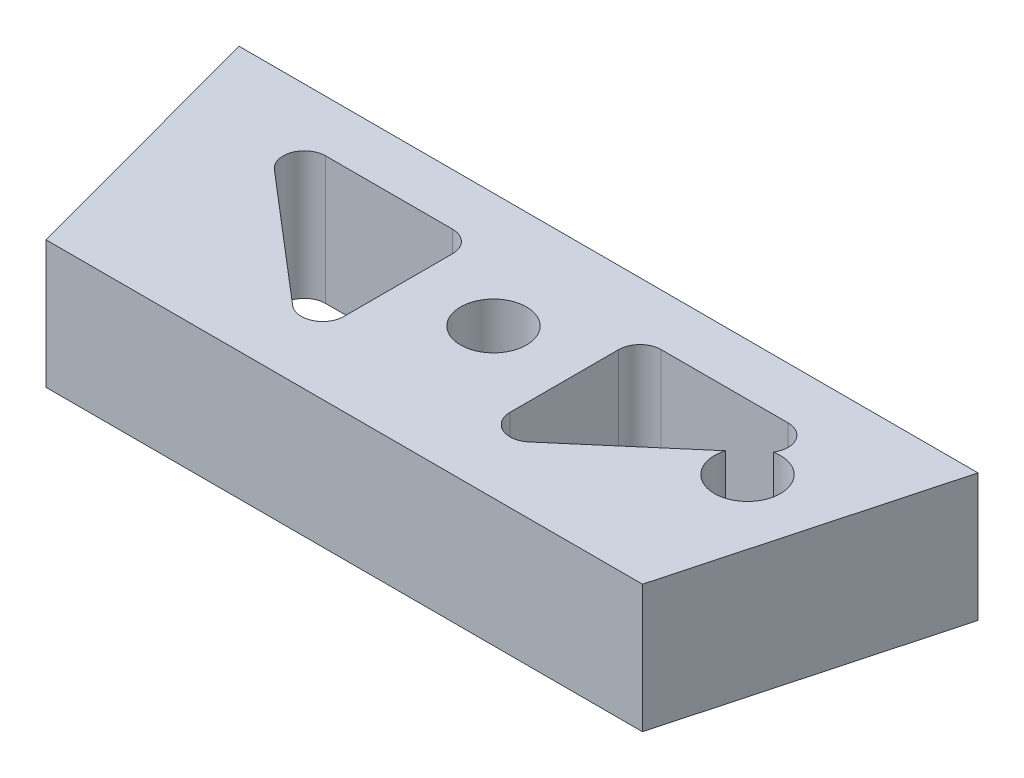
from build123d import *

# Parameters (mm, degrees)
EXTRUDE_1_DEPTH     = 1
EXTRUDE_START       = 5
EXTRUDE_2_DEPTH     = 5
CUT_EXTRUDE_1_REACH = 25.286
SKETCH_2_R          = 1.55
SKETCH_3_R          = 1.55
CUT_EXTRUDE_2_DEPTH = 6


with BuildPart() as part:
    # 草图1 → 凸台-拉伸1 (new body)
    with BuildSketch(Plane(origin=(0, 0, 0), x_dir=(1, 0, 0), z_dir=(0, 1, 0))):
        Polygon((-0.862647581, -12.802774991), (12.834963402, -12.802774991), (16.186049163, -0.402774991), (-18.501877746, -0.402774991), (-15.165036598, -12.802774991), align=None)
        with BuildLine():
            Line((-5.055880083, -8.924536815), (-5.055880083, -3.827423548))
            ThreePointArc((-5.055880083, -3.827423548), (-5.348773301, -3.120316767), (-6.055880083, -2.827423548))
            Line((-6.055880083, -2.827423548), (-12.010923306, -2.827423548))
            ThreePointArc((-12.010923306, -2.827423548), (-12.948929404, -3.480804795), (-12.661184313, -4.587134428))
            Line((-12.661184313, -4.587134428), (-6.70614109, -9.684247695))
            ThreePointArc((-6.70614109, -9.684247695), (-5.63770608, -9.832903758), (-5.055880083, -8.924536815))
        make_face(mode=Mode.SUBTRACT)
        with BuildLine():
            Line((10.34535573, -4.587134428), (4.390312507, -9.684247695))
            ThreePointArc((4.390312507, -9.684247695), (3.321877497, -9.832903758), (2.740051499, -8.924536815))
            Line((2.740051499, -8.924536815), (2.740051499, -3.827423548))
            ThreePointArc((2.740051499, -3.827423548), (3.032944718, -3.120316767), (3.740051499, -2.827423548))
            Line((3.740051499, -2.827423548), (9.695094722, -2.827423548))
            ThreePointArc((9.695094722, -2.827423548), (10.63310082, -3.480804795), (10.34535573, -4.587134428))
        make_face(mode=Mode.SUBTRACT)
    extrude(amount=-EXTRUDE_1_DEPTH)

    # 草图1<8> → 凸台-拉伸2 (add)
    with BuildSketch(Plane(origin=(0, 0, 0), x_dir=(1, 0, 0), z_dir=(0, 1, 0)).offset(EXTRUDE_START)):
        Polygon((-0.862647581, -12.802774991), (12.834963402, -12.802774991), (16.186049163, -0.402774991), (-18.501877746, -0.402774991), (-15.165036598, -12.802774991), align=None)
        with BuildLine():
            Line((-5.055880083, -8.924536815), (-5.055880083, -3.827423548))
            ThreePointArc((-5.055880083, -3.827423548), (-5.348773301, -3.120316767), (-6.055880083, -2.827423548))
            Line((-6.055880083, -2.827423548), (-12.010923306, -2.827423548))
            ThreePointArc((-12.010923306, -2.827423548), (-12.948929404, -3.480804795), (-12.661184313, -4.587134428))
            Line((-12.661184313, -4.587134428), (-6.70614109, -9.684247695))
            ThreePointArc((-6.70614109, -9.684247695), (-5.63770608, -9.832903758), (-5.055880083, -8.924536815))
        make_face(mode=Mode.SUBTRACT)
        with BuildLine():
            Line((10.34535573, -4.587134428), (4.390312507, -9.684247695))
            ThreePointArc((4.390312507, -9.684247695), (3.321877497, -9.832903758), (2.740051499, -8.924536815))
            Line((2.740051499, -8.924536815), (2.740051499, -3.827423548))
            ThreePointArc((2.740051499, -3.827423548), (3.032944718, -3.120316767), (3.740051499, -2.827423548))
            Line((3.740051499, -2.827423548), (9.695094722, -2.827423548))
            ThreePointArc((9.695094722, -2.827423548), (10.63310082, -3.480804795), (10.34535573, -4.587134428))
        make_face(mode=Mode.SUBTRACT)
    extrude(amount=-EXTRUDE_2_DEPTH)

    # 草图2 → 切除-拉伸1 (cut, up to next)
    with BuildSketch(Plane(origin=(0, 5, 0), x_dir=(1, 0, 0), z_dir=(0, 1, 0)), mode=Mode.PRIVATE) as cut_extrude_1_sk1:
        with Locations(Location((-1.157914292, -5.802774991, 0), (0, 0, 270))):
            Circle(SKETCH_2_R)
    cut_extrude_1_tool1 = extrude(cut_extrude_1_sk1.sketch, amount=-CUT_EXTRUDE_1_REACH, mode=Mode.PRIVATE) & part.part
    add(cut_extrude_1_tool1.solids().sort_by_distance((-1.157914, 5, 5.802775))[0], mode=Mode.SUBTRACT)

    # 草图3 → 切除-拉伸2 (cut)
    with BuildSketch(Plane(origin=(0, 5, 0), x_dir=(1, 0, 0), z_dir=(0, 1, 0))):
        with Locations((10.842085708, -5.882306345)):
            Circle(SKETCH_3_R)
    extrude(amount=-CUT_EXTRUDE_2_DEPTH, mode=Mode.SUBTRACT)


solid = part.part
